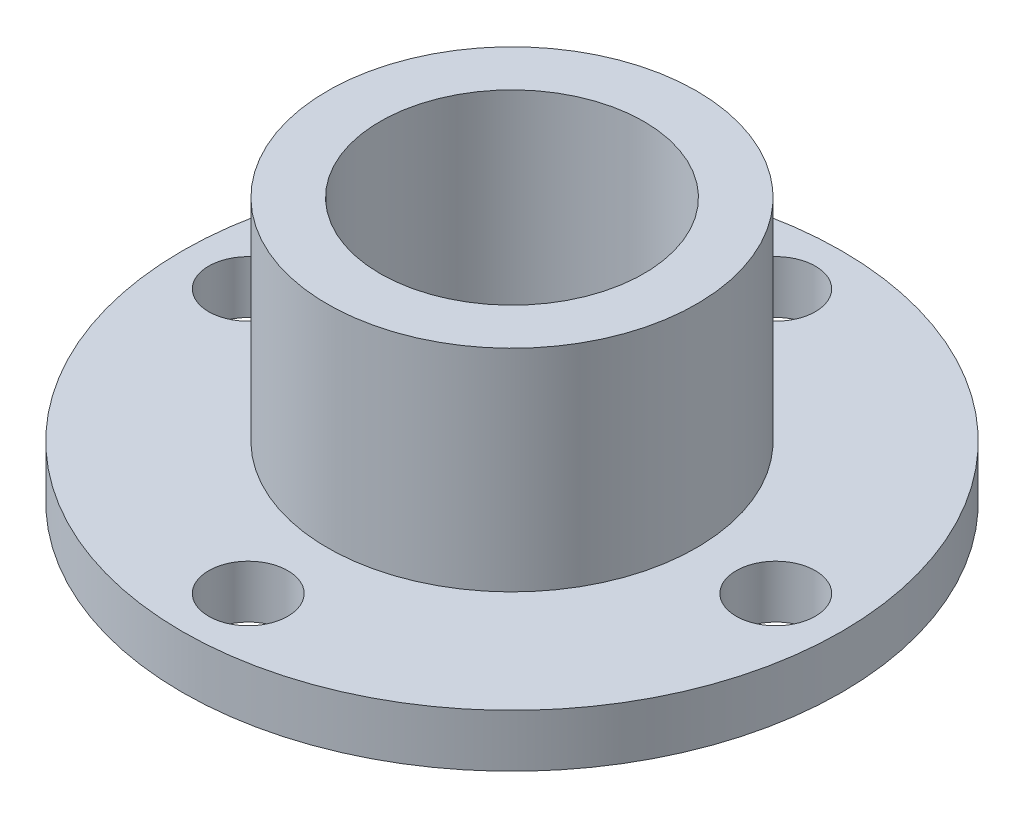
from build123d import *

# Parameters (mm, degrees)
CUT_EXTRUDE1_REACH = 21.404
SKETCH2_R          = 1.5


with BuildPart() as part:
    # Sketch1 → Revolve1 (revolve)
    with BuildSketch(Plane(origin=(0, 0, 0), x_dir=(0, 0, -1), z_dir=(1, 0, 0)), mode=Mode.PRIVATE) as revolve1_sk:
        Polygon((-5, 0), (-12.5, 0), (-12.5, 2), (-7, 2), (-7, 10), (-5, 10), align=None)
    revolve(revolve1_sk.sketch.rotate(Axis((0, -0.941879477, 0), (0, 1, 0)), 180), axis=Axis((0, -0.941879477, 0), (0, 1, 0)))

    # Sketch2 → Cut-Extrude1 (cut, up to next)
    with BuildSketch(Plane(origin=(0, 2, 0), x_dir=(1, 0, 0), z_dir=(0, 1, 0)), mode=Mode.PRIVATE) as cut_extrude1_sk1:
        with Locations(Location((0, 10, 0), (0, 0, 270))):
            Circle(SKETCH2_R)
    cut_extrude1_tool1 = extrude(cut_extrude1_sk1.sketch, amount=-CUT_EXTRUDE1_REACH, mode=Mode.PRIVATE) & part.part
    # Sketch2 → Cut-Extrude1 (cut, up to next)
    with BuildSketch(Plane(origin=(0, 2, 0), x_dir=(1, 0, 0), z_dir=(0, 1, 0)), mode=Mode.PRIVATE) as cut_extrude1_sk2:
        with Locations(Location((10, 0, 0), (0, 0, 270))):
            Circle(SKETCH2_R)
    cut_extrude1_tool2 = extrude(cut_extrude1_sk2.sketch, amount=-CUT_EXTRUDE1_REACH, mode=Mode.PRIVATE) & part.part
    # Sketch2 → Cut-Extrude1 (cut, up to next)
    with BuildSketch(Plane(origin=(0, 2, 0), x_dir=(1, 0, 0), z_dir=(0, 1, 0)), mode=Mode.PRIVATE) as cut_extrude1_sk3:
        with Locations(Location((0, -10, 0), (0, 0, 270))):
            Circle(SKETCH2_R)
    cut_extrude1_tool3 = extrude(cut_extrude1_sk3.sketch, amount=-CUT_EXTRUDE1_REACH, mode=Mode.PRIVATE) & part.part
    # Sketch2 → Cut-Extrude1 (cut, up to next)
    with BuildSketch(Plane(origin=(0, 2, 0), x_dir=(1, 0, 0), z_dir=(0, 1, 0)), mode=Mode.PRIVATE) as cut_extrude1_sk4:
        with Locations(Location((-10, 0, 0), (0, 0, 270))):
            Circle(SKETCH2_R)
    cut_extrude1_tool4 = extrude(cut_extrude1_sk4.sketch, amount=-CUT_EXTRUDE1_REACH, mode=Mode.PRIVATE) & part.part
    add(cut_extrude1_tool1.solids().sort_by_distance((0, 2, -10))[0], mode=Mode.SUBTRACT)
    add(cut_extrude1_tool2.solids().sort_by_distance((10, 2, 0))[0], mode=Mode.SUBTRACT)
    add(cut_extrude1_tool3.solids().sort_by_distance((0, 2, 10))[0], mode=Mode.SUBTRACT)
    add(cut_extrude1_tool4.solids().sort_by_distance((-10, 2, 0))[0], mode=Mode.SUBTRACT)


solid = part.part
